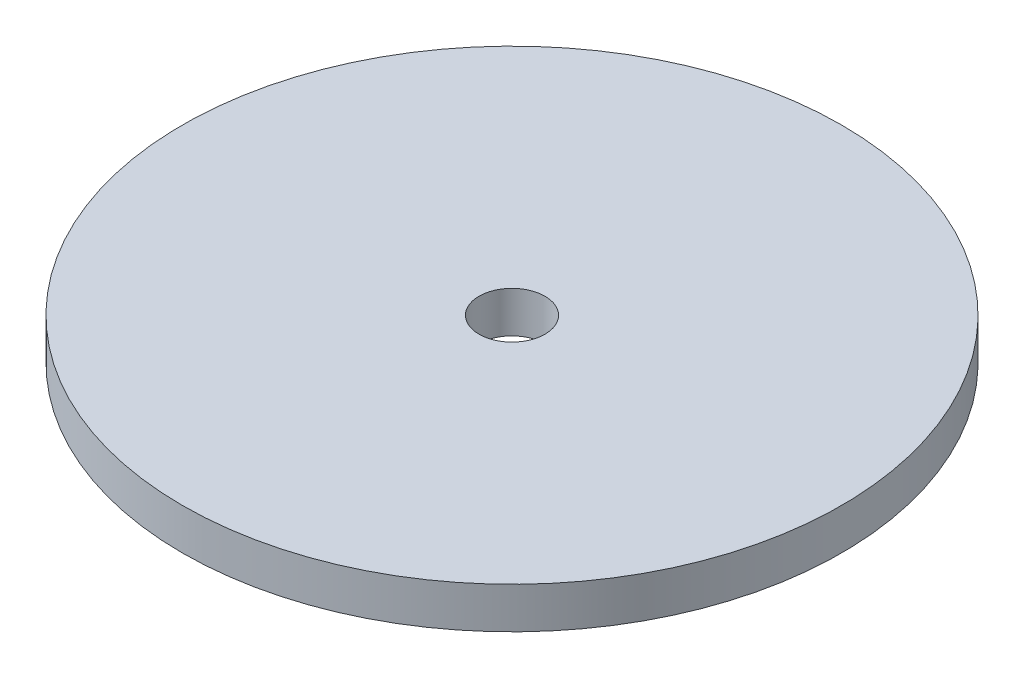
from build123d import *

# Parameters (mm, degrees)
SKETCH1_R           = 25.4
BOSS_EXTRUDE1_DEPTH = 3.175
SKETCH2_R           = 2.54
CUT_EXTRUDE1_DEPTH  = 3.175


with BuildPart() as part:
    # Sketch1 → Boss-Extrude1 (new body)
    with BuildSketch(Plane(origin=(0, 0, 0), x_dir=(1, 0, 0), z_dir=(0, 1, 0))):
        with Locations(Location((0, 0, 0), (0, 0, 270))):
            Circle(SKETCH1_R)
    extrude(amount=BOSS_EXTRUDE1_DEPTH)

    # Sketch2 → Cut-Extrude1 (cut)
    with BuildSketch(Plane(origin=(0, 3.175, 0), x_dir=(1, 0, 0), z_dir=(0, 1, 0))):
        with Locations(Location((0, 0, 0), (0, 0, 270))):
            Circle(SKETCH2_R)
    extrude(amount=-CUT_EXTRUDE1_DEPTH, mode=Mode.SUBTRACT)


solid = part.part
